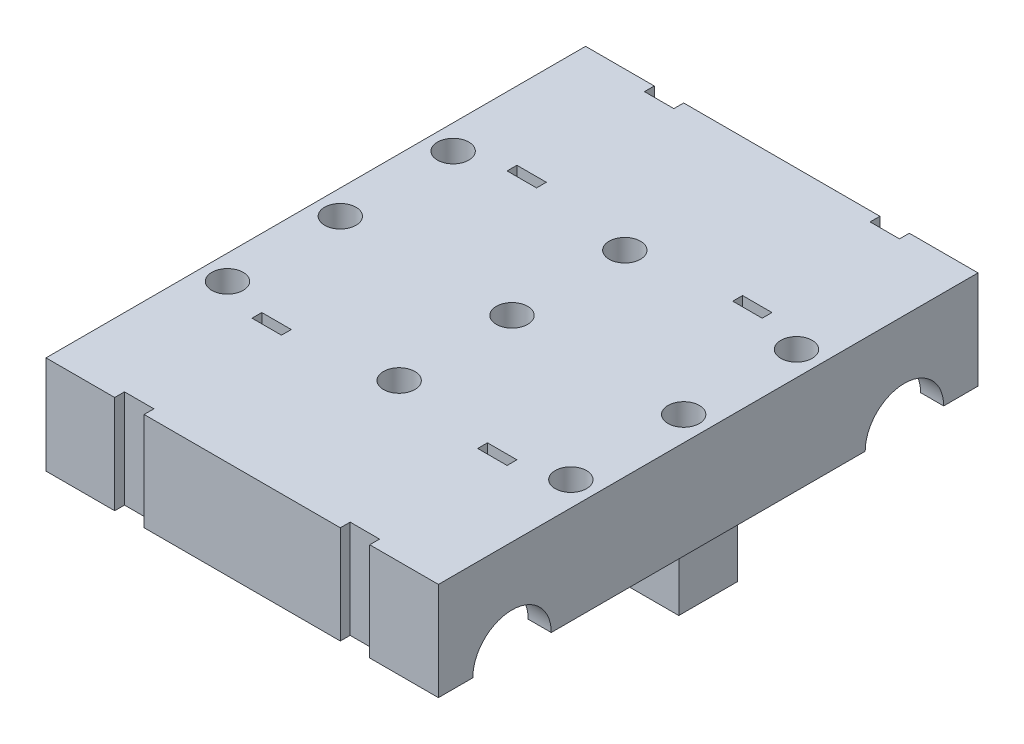
from build123d import *

# Parameters (mm, degrees)
SKETCH_1_W          = 40000
SKETCH_1_H          = 55000
EXTRUDE_1_DEPTH     = 10000
SKETCH_2_R          = 6500
CUT_EXTRUDE_1_DEPTH = 17650
SKETCH_3_W          = 3000
SKETCH_3_H          = 1000
CUT_EXTRUDE_2_DEPTH = 35300
SKETCH_5_R          = 1600
CUT_EXTRUDE_4_DEPTH = 35300
SKETCH_7_R          = 4000
CUT_EXTRUDE_5_DEPTH = 100000
SCALE_1_SCALE       = 0.001
EXTRUDE_3_DEPTH     = 10
SKETCH_10_W         = 3
SKETCH_10_H         = 1.5
CUT_EXTRUDE_6_DEPTH = 10


with BuildPart() as part:
    # 草圖1 → 填料-伸長1 (new body)
    with BuildSketch(Plane(origin=(0, 0, 0), x_dir=(1, 0, 0), z_dir=(0, 1, 0))):
        Rectangle(SKETCH_1_W, SKETCH_1_H)
    extrude(amount=EXTRUDE_1_DEPTH)

    # 草圖2 → 除料-伸長1 (cut, symmetric)
    with BuildSketch(Plane(origin=(0, 0, 0), x_dir=(0, 0, -1), z_dir=(1, 0, 0))):
        with Locations((-20000, 0)):
            Circle(SKETCH_2_R)
        with Locations((20000, 0)):
            Circle(SKETCH_2_R)
    extrude(amount=CUT_EXTRUDE_1_DEPTH, both=True, mode=Mode.SUBTRACT)

    # 草圖3 → 除料-伸長2 (cut)
    with BuildSketch(Plane.XZ):
        with Locations((-11500, 27000)):
            Rectangle(SKETCH_3_W, SKETCH_3_H)
        with Locations((11500, 27000)):
            Rectangle(SKETCH_3_W, SKETCH_3_H)
        with Locations((11500, 13000)):
            Rectangle(SKETCH_3_W, SKETCH_3_H)
        with Locations((-11500, 13000)):
            Rectangle(SKETCH_3_W, SKETCH_3_H)
        with Locations((-11500, -13000)):
            Rectangle(SKETCH_3_W, SKETCH_3_H)
        with Locations((11500, -13000)):
            Rectangle(SKETCH_3_W, SKETCH_3_H)
        with Locations((11500, -27000)):
            Rectangle(SKETCH_3_W, SKETCH_3_H)
        with Locations((-11500, -27000)):
            Rectangle(SKETCH_3_W, SKETCH_3_H)
    extrude(amount=-CUT_EXTRUDE_2_DEPTH, mode=Mode.SUBTRACT)

    # 草圖5 → 除料-伸長4 (cut)
    with BuildSketch(Plane.XZ):
        with Locations(Location((-17500, 11500, 0), (0, 0, 270))):
            Circle(SKETCH_5_R)
        with Locations(Location((17500, 11500, 0), (0, 0, 270))):
            Circle(SKETCH_5_R)
        with Locations(Location((17500, -11500, 0), (0, 0, 270))):
            Circle(SKETCH_5_R)
        with Locations(Location((-17500, -11500, 0), (0, 0, 270))):
            Circle(SKETCH_5_R)
        with Locations(Location((0, 11500, 0), (0, 0, 270))):
            Circle(SKETCH_5_R)
        with Locations(Location((0, 0, 0), (0, 0, 270))):
            Circle(SKETCH_5_R)
        with Locations(Location((0, -11500, 0), (0, 0, 270))):
            Circle(SKETCH_5_R)
        with Locations(Location((-17500, 0, 0), (0, 0, 270))):
            Circle(SKETCH_5_R)
        with Locations(Location((17500, 0, 0), (0, 0, 270))):
            Circle(SKETCH_5_R)
    extrude(amount=-CUT_EXTRUDE_4_DEPTH, mode=Mode.SUBTRACT)

    # 草圖7 → 除料-伸長5 (cut)
    with BuildSketch(Plane(origin=(20000, 0, 0), x_dir=(0, 0, -1), z_dir=(1, 0, 0))):
        with Locations((20000, 0)):
            Circle(SKETCH_7_R)
        with Locations((-20000, 0)):
            Circle(SKETCH_7_R)
    extrude(amount=-CUT_EXTRUDE_5_DEPTH, mode=Mode.SUBTRACT)


with BuildPart() as part_1:
    # 縮放比例1: scaled about (0, 0, 0)
    add(part.part.scale(SCALE_1_SCALE))

    # 草圖9 → 填料-伸長3 (add)
    with BuildSketch(Plane.XZ):
        with BuildLine():
            Line((-15, -2), (-1.661324773, -2))
            ThreePointArc((-1.661324773, -2), (0, -2.6), (1.661324773, -2))
            Line((1.661324773, -2), (15, -2))
            Line((15, -2), (15, -8))
            Line((15, -8), (-15, -8))
            Line((-15, -8), (-15, -2))
        make_face()
    extrude(amount=EXTRUDE_3_DEPTH)

    # 草圖10 → 除料-伸長6 (cut)
    with BuildSketch(Plane(origin=(0, 0, -8), x_dir=(-1, 0, 0), z_dir=(0, 0, -1))):
        with Locations((-7.5, -4.25)):
            Rectangle(SKETCH_10_W, SKETCH_10_H)
        with Locations((7.5, -4.25)):
            Rectangle(SKETCH_10_W, SKETCH_10_H)
    extrude(amount=-CUT_EXTRUDE_6_DEPTH, mode=Mode.SUBTRACT)


solid = part_1.part
